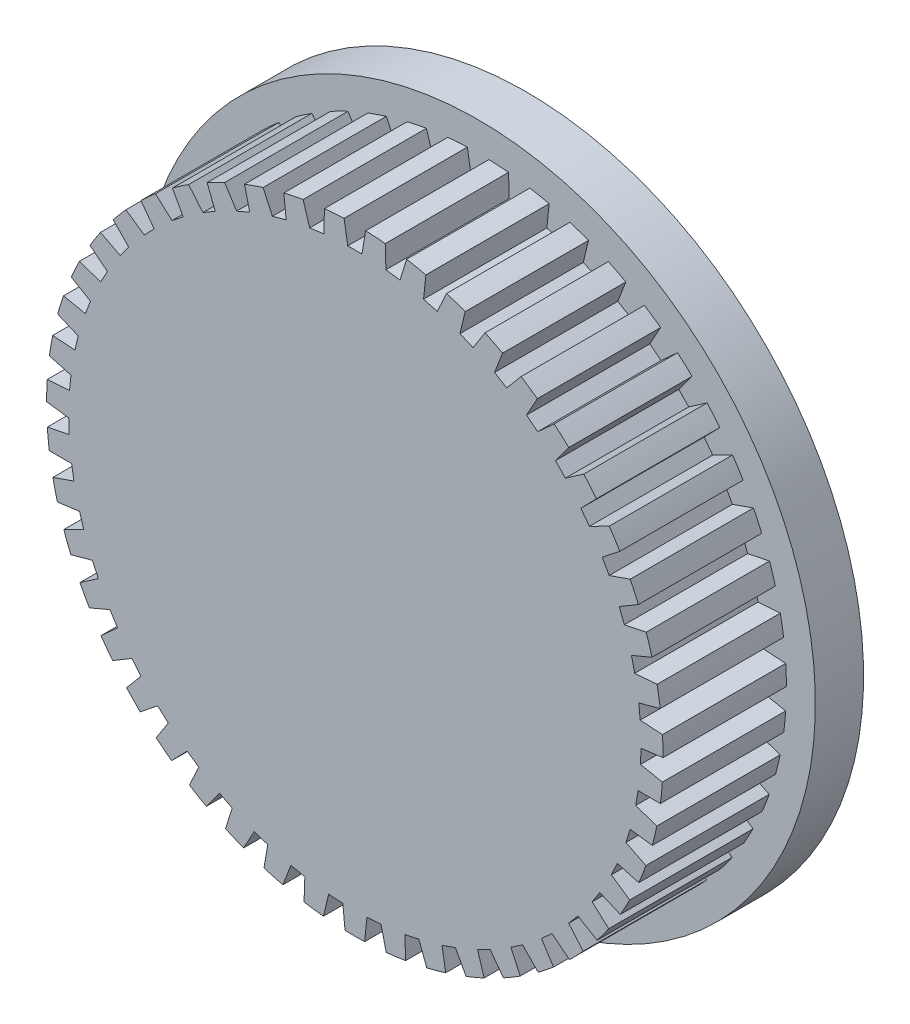
from build123d import *

# Parameters (mm, degrees)
SKETCH3_R           = 16.25
BOSS_EXTRUDE2_DEPTH = 3.25
CUT_EXTRUDE2_DEPTH  = 24.209642393
CIRPATTERN3_COUNT   = 47
SKETCH5_R           = 17.78
BOSS_EXTRUDE3_DEPTH = 2.54


with BuildPart() as part:
    # Sketch3 → Boss-Extrude2 (new, symmetric)
    with BuildSketch(Plane.XY):
        with Locations(Location((0, 0, 0), (0, 0, 180))):
            Circle(SKETCH3_R)
    extrude(amount=BOSS_EXTRUDE2_DEPTH, both=True)

    # Sketch1 → Cut-Extrude2 (cut, symmetric)
    with BuildSketch(Plane.XY):
        Polygon((-0.375, 15.08), (0.375, 15.08), (0.654345854, 16.756075122), (-0.654345854, 16.756075122), align=None)
    cut_extrude2 = extrude(amount=CUT_EXTRUDE2_DEPTH, both=True, mode=Mode.SUBTRACT)

    # CirPattern3: Cut-Extrude2 ×47 about axis
    cirpattern3_axis = Axis((0, 0, 0), (0, 0, 1))
    for i in range(1, CIRPATTERN3_COUNT):
        add(cut_extrude2.rotate(cirpattern3_axis, i * 360 / CIRPATTERN3_COUNT), mode=Mode.SUBTRACT)

    # Sketch5 → Boss-Extrude3 (add)
    with BuildSketch(Plane(origin=(0, 0, -3.25), x_dir=(-1, 0, 0), z_dir=(0, 0, -1))):
        Circle(SKETCH5_R)
    extrude(amount=BOSS_EXTRUDE3_DEPTH)


solid = part.part
